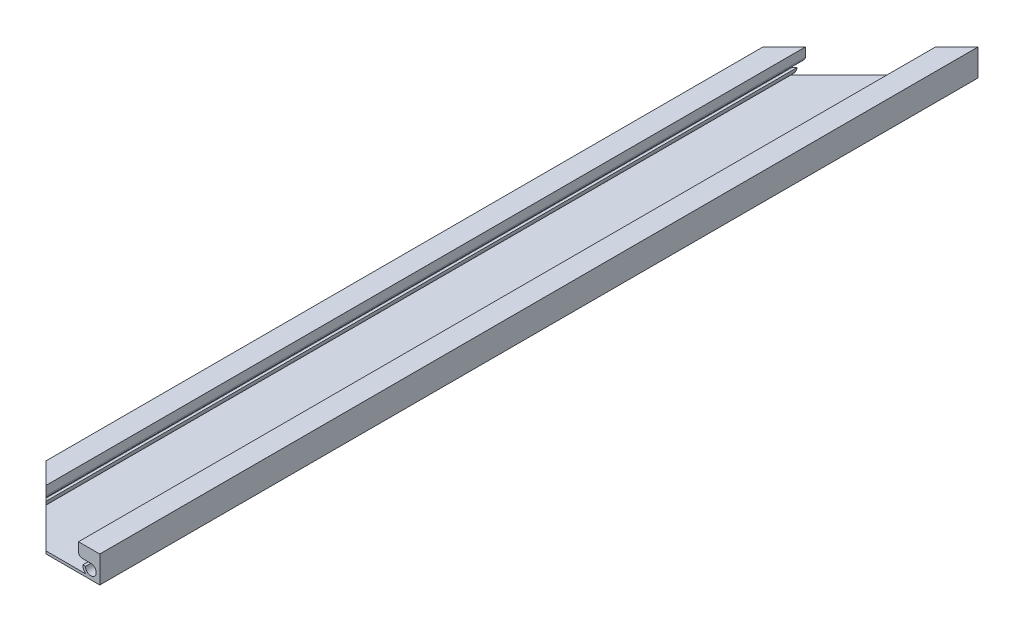
from build123d import *

# Parameters (mm, degrees)
SKETCH_1_W               = 60
SKETCH_1_H               = 15
EXTRUDE_1_DEPTH          = 520
SKETCH_2_R               = 3
CUT_EXTRUDE_1_DEPTH      = 521.918659677
CUT_EXTRUDE_2_DEPTH      = 521.918659677
SKETCH_4_W               = 36.3
SKETCH_4_H               = 7
CUT_EXTRUDE_3_DEPTH      = 521.918659677
FILLET_1_R               = 2
CUT_EXTRUDE_4_DEPTH      = 522.080607968
CUT_EXTRUDE_6_DEPTH      = 522.080607968
CUT_EXTRUDE_6_DEPTH_BACK = 522.080607968
SKETCH_7_W               = 30
SKETCH_7_H               = 30


with BuildPart() as part:
    # 스케치1 → 보스-돌출1 (new body)
    with BuildSketch(Plane.XY):
        Rectangle(SKETCH_1_W, SKETCH_1_H)
    extrude(amount=EXTRUDE_1_DEPTH)

    # 스케치2 → 컷-돌출1 (cut, through all)
    with BuildSketch(Plane(origin=(0, 0, 0), x_dir=(-1, 0, 0), z_dir=(0, 0, -1))):
        with Locations((-25, -2.5)):
            Circle(SKETCH_2_R)
        with Locations((25, -2.5)):
            Circle(SKETCH_2_R)
    extrude(amount=-CUT_EXTRUDE_1_DEPTH, mode=Mode.SUBTRACT)

    # 스케치3 → 컷-돌출2 (cut, through all)
    with BuildSketch(Plane(origin=(0, 0, 0), x_dir=(-1, 0, 0), z_dir=(0, 0, -1))):
        with BuildLine():
            Line((-22.171572875, -6), (22.171572875, -6))
            ThreePointArc((22.171572875, -6), (20.939339828, -4.439339828), (20.5, -2.5))
            Line((20.5, -2.5), (25, -2.5))
            Line((25, -2.5), (25, 0.5))
            Line((25, 0.5), (-25, 0.5))
            Line((-25, 0.5), (-25, -2.5))
            Line((-25, -2.5), (-20.5, -2.5))
            ThreePointArc((-20.5, -2.5), (-20.939339828, -4.439339828), (-22.171572875, -6))
        make_face()
    extrude(amount=-CUT_EXTRUDE_2_DEPTH, mode=Mode.SUBTRACT)

    # 스케치4 → 컷-돌출3 (cut, through all)
    with BuildSketch(Plane(origin=(0, 0, 0), x_dir=(-1, 0, 0), z_dir=(0, 0, -1))):
        with Locations((0.006888359, 4)):
            Rectangle(SKETCH_4_W, SKETCH_4_H)
    extrude(amount=-CUT_EXTRUDE_3_DEPTH, mode=Mode.SUBTRACT)

    # 필렛1
    fillet_1_edges = [part.edges().sort_by_distance(p)[0] for p in [
        (-18.156888359, 0.5, 260),
        (18.143111641, 0.5, 260),
    ]]
    fillet(fillet_1_edges, radius=FILLET_1_R)

    # 스케치5 → 컷-돌출4 (cut, through all)
    with BuildSketch(Plane.XZ.offset(7.5)):
        Polygon((-30, 520), (-30, 460), (30, 520), align=None)
        Polygon((-30, 0), (30, 0), (-30, 60), align=None)
    extrude(amount=-CUT_EXTRUDE_4_DEPTH, mode=Mode.SUBTRACT)

    # 스케치7 → 컷-돌출6 (cut, two sides: drawn at the far end of the back side and taken through both)
    with BuildSketch(Plane.XZ.offset(7.5).offset(-CUT_EXTRUDE_6_DEPTH_BACK)):
        with Locations((15, 505)):
            Rectangle(SKETCH_7_W, SKETCH_7_H)
    extrude(amount=CUT_EXTRUDE_6_DEPTH + CUT_EXTRUDE_6_DEPTH_BACK, mode=Mode.SUBTRACT)


solid = part.part
